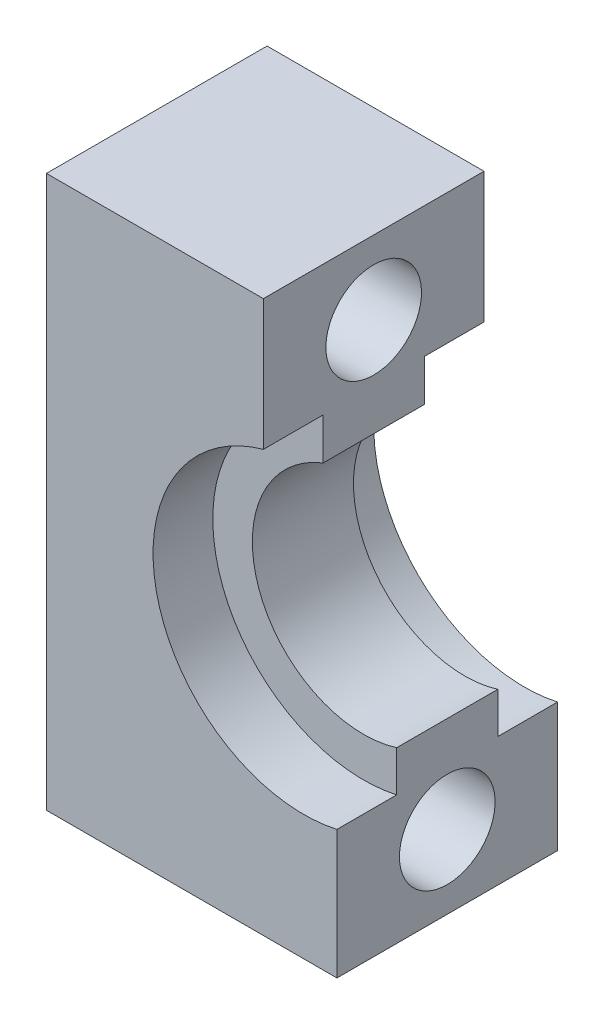
from build123d import *

# Parameters (mm, degrees)
BOSS_EXTRUDE2_DEPTH = 6
BOSS_EXTRUDE3_DEPTH = 2.75
CUT_EXTRUDE1_REACH  = 24.597
SKETCH5_R           = 2.6


with BuildPart() as part:
    # Sketch3 → Boss-Extrude2 (new, symmetric)
    with BuildSketch(Plane.XY):
        with BuildLine():
            Line((0, -15), (0, 15))
            Line((0, 15), (11.8, 15))
            Line((11.8, 15), (11.8, 7.899367063))
            ThreePointArc((11.8, 7.899367063), (6.047801043, -2.000632837), (15.8, -8))
            Line((15.8, -8), (15.8, -15))
            Line((15.8, -15), (0, -15))
        make_face()
    extrude(amount=BOSS_EXTRUDE2_DEPTH, both=True)

    # Sketch4 → Boss-Extrude3 (add, symmetric)
    with BuildSketch(Plane.XY):
        with BuildLine():
            Line((11.8, 8.21035931), (11.8, 5.635822921))
            ThreePointArc((11.8, 5.635822921), (8.290570464, -2.001228215), (15.8, -5.776028047))
            Line((15.8, -5.776028047), (15.8, -8.30722577))
            ThreePointArc((15.8, -8.30722577), (5.738786153, -2.000586358), (11.8, 8.21035931))
        make_face()
    extrude(amount=BOSS_EXTRUDE3_DEPTH, both=True)

    # Sketch5 → Cut-Extrude1 (cut, up to next)
    with BuildSketch(Plane(origin=(0, 0, 0), x_dir=(0, 0, -1), z_dir=(1, 0, 0)), mode=Mode.PRIVATE) as cut_extrude1_sk1:
        with Locations(Location((0, 11, 0), (0, 0, 270))):
            Circle(SKETCH5_R)
    cut_extrude1_tool1 = extrude(cut_extrude1_sk1.sketch, amount=CUT_EXTRUDE1_REACH, mode=Mode.PRIVATE) & part.part
    # Sketch5 → Cut-Extrude1 (cut, up to next)
    with BuildSketch(Plane(origin=(0, 0, 0), x_dir=(0, 0, -1), z_dir=(1, 0, 0)), mode=Mode.PRIVATE) as cut_extrude1_sk2:
        with Locations(Location((0, -11, 0), (0, 0, 180))):
            Circle(SKETCH5_R)
    cut_extrude1_tool2 = extrude(cut_extrude1_sk2.sketch, amount=CUT_EXTRUDE1_REACH, mode=Mode.PRIVATE) & part.part
    add(cut_extrude1_tool1.solids().sort_by_distance((0, 11, 0))[0], mode=Mode.SUBTRACT)
    add(cut_extrude1_tool2.solids().sort_by_distance((0, -11, 0))[0], mode=Mode.SUBTRACT)


solid = part.part
